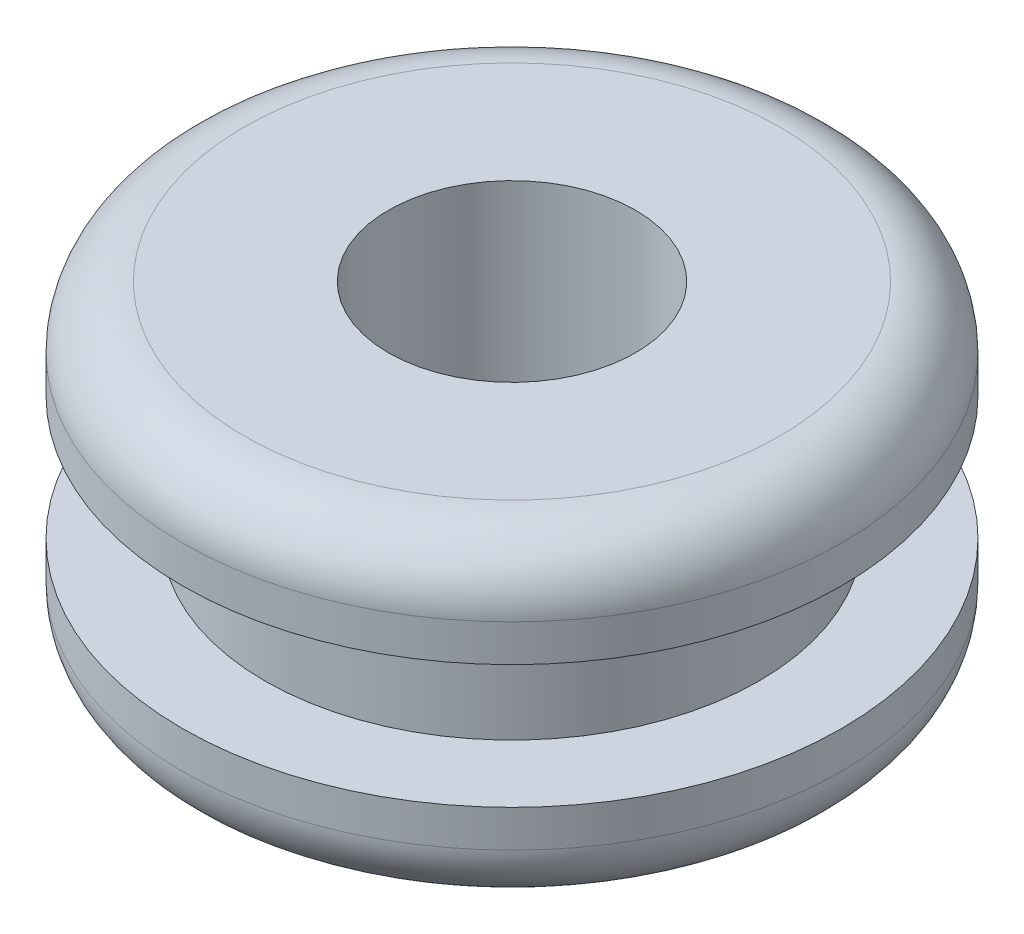
from build123d import *


with BuildPart() as part:
    # Sketch1 → Revolve1 (revolve)
    with BuildSketch(Plane(origin=(0, 0, 0), x_dir=(0, 0, -1), z_dir=(1, 0, 0)), mode=Mode.PRIVATE) as revolve1_sk:
        with BuildLine():
            Line((-1.5, -1.95), (-1.5, 1.95))
            Line((-1.5, 1.95), (-3.25, 1.95))
            ThreePointArc((-3.25, 1.95), (-3.780330086, 1.730330086), (-4, 1.2))
            Line((-4, 1.2), (-4, 0.75))
            Line((-4, 0.75), (-3, 0.75))
            Line((-3, 0.75), (-3, -0.75))
            Line((-3, -0.75), (-4, -0.75))
            Line((-4, -0.75), (-4, -1.2))
            ThreePointArc((-4, -1.2), (-3.780330086, -1.730330086), (-3.25, -1.95))
            Line((-3.25, -1.95), (-1.5, -1.95))
        make_face()
    revolve(revolve1_sk.sketch.rotate(Axis((0, 0, 0), (0, 1, 0)), 180), axis=Axis((0, 0, 0), (0, 1, 0)))


solid = part.part
